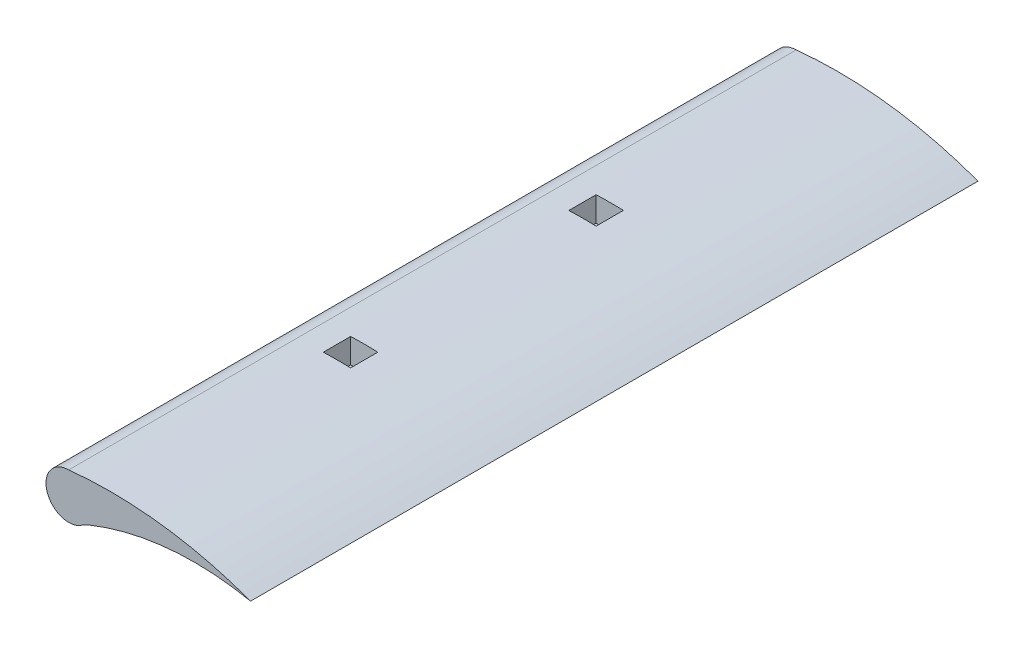
from build123d import *

# Parameters (mm, degrees)
BOSS_EXTRUDE2_DEPTH = 40
SKETCH3_W           = 3
SKETCH3_H           = 3
CUT_EXTRUDE2_DEPTH  = 45.805132264


with BuildPart() as part:
    # Sketch1 → Boss-Extrude2 (new, symmetric)
    with BuildSketch(Plane.XY):
        with BuildLine():
            ThreePointArc((0, 2.5), (-2.392060476, -0.726668205), (1.390587434, -2.077562656))
            ThreePointArc((1.390587434, -2.077562656), (1.797326731, -1.834582069), (2.226834249, -1.634582786))
            ThreePointArc((2.226834249, -1.634582786), (10.992934155, 0.492745515), (20, 0))
            ThreePointArc((20, 0), (10.143001238, 2.394009907), (0, 2.5))
        make_face()
    extrude(amount=BOSS_EXTRUDE2_DEPTH, both=True)

    # Sketch3 → Cut-Extrude2 (cut, through all)
    with BuildSketch(Plane(origin=(0, 0, 0), x_dir=(1, 0, 0), z_dir=(0, 1, 0))):
        with Locations((4.5, -13.5)):
            Rectangle(SKETCH3_W, SKETCH3_H)
        with Locations((4.5, 13.5)):
            Rectangle(SKETCH3_W, SKETCH3_H)
    extrude(amount=CUT_EXTRUDE2_DEPTH, mode=Mode.SUBTRACT)


solid = part.part
